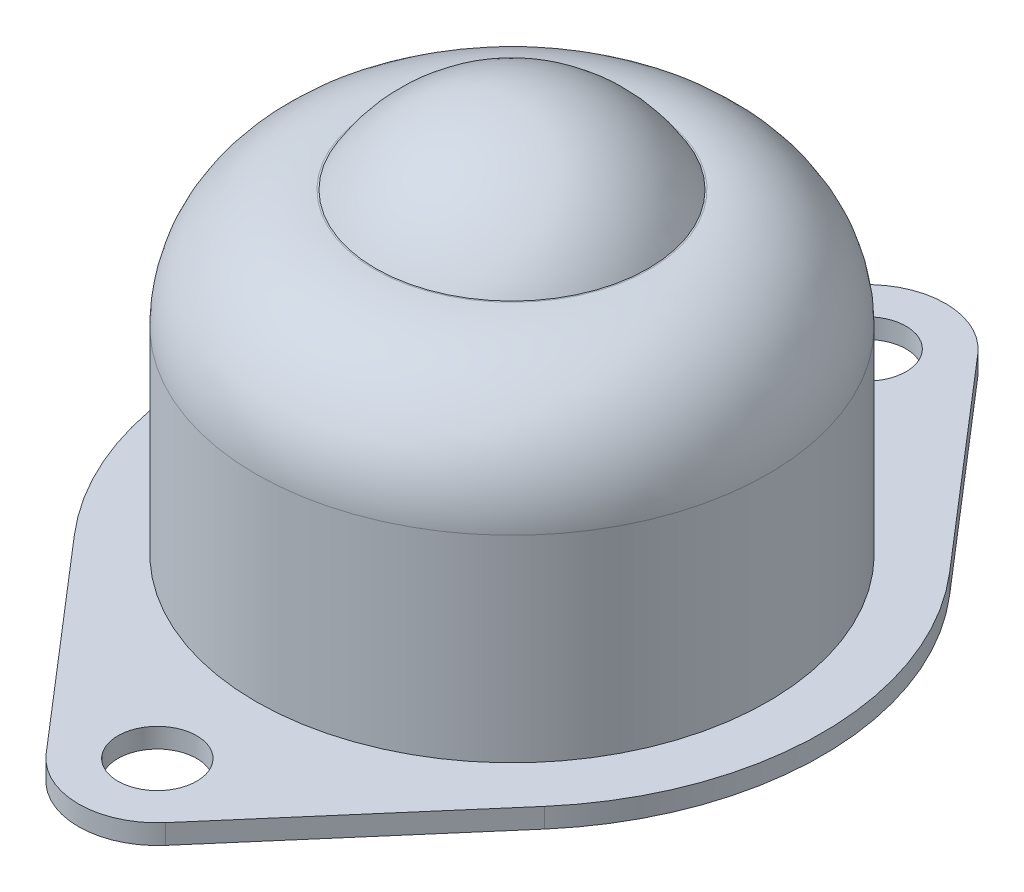
from build123d import *

# Parameters (mm, degrees)
SKETCH1_R           = 3.175
BOSS_EXTRUDE1_DEPTH = 1.5875
SKETCH2_R           = 20.6375
BOSS_EXTRUDE2_DEPTH = 25.4
FILLET1_R           = 9.525


with BuildPart() as part:
    # Sketch1 → Boss-Extrude1 (new body)
    with BuildSketch(Plane(origin=(0, 0, 0), x_dir=(1, 0, 0), z_dir=(0, 1, 0))):
        with BuildLine():
            ThreePointArc((-18.941091873, 16.316710411), (-25, 0), (-18.941091873, -16.316710411))
            Line((-18.941091873, -16.316710411), (-4.811037336, -32.719444444))
            ThreePointArc((-4.811037336, -32.719444444), (0, -34.925), (4.811037336, -32.719444444))
            Line((4.811037336, -32.719444444), (18.941091873, -16.316710411))
            ThreePointArc((18.941091873, -16.316710411), (25, 0), (18.941091873, 16.316710411))
            Line((18.941091873, 16.316710411), (4.811037336, 32.719444444))
            ThreePointArc((4.811037336, 32.719444444), (0, 34.925), (-4.811037336, 32.719444444))
            Line((-4.811037336, 32.719444444), (-18.941091873, 16.316710411))
        make_face()
        with Locations(Location((0, -28.575, 0), (0, 0, 270))):
            Circle(SKETCH1_R, mode=Mode.SUBTRACT)
        with Locations(Location((0, 28.575, 0), (0, 0, 270))):
            Circle(SKETCH1_R, mode=Mode.SUBTRACT)
    extrude(amount=BOSS_EXTRUDE1_DEPTH)

    # Sketch2 → Boss-Extrude2 (add)
    with BuildSketch(Plane(origin=(0, 1.5875, 0), x_dir=(1, 0, 0), z_dir=(0, 1, 0))):
        with Locations(Location((0, 0, 0), (0, 0, 270))):
            Circle(SKETCH2_R)
    extrude(amount=BOSS_EXTRUDE2_DEPTH)

    # Fillet1
    fillet1_edges = [part.edges().sort_by_distance(p)[0] for p in [
        (0, 26.9875, -20.6375),
    ]]
    fillet(fillet1_edges, radius=FILLET1_R)

    # Sketch4 → Revolve1 (revolve)
    with BuildSketch(Plane(origin=(0, 0, 0), x_dir=(0, 0, -1), z_dir=(1, 0, 0))):
        with BuildLine():
            Line((10.998522628, 26.9875), (0, 26.9875))
            Line((0, 26.9875), (0, 33.3375))
            ThreePointArc((0, 33.3375), (6.35, 31.636022628), (10.998522628, 26.9875))
        make_face()
    revolve(axis=Axis((0, 26.9875, 0), (0, 1, 0)))


solid = part.part
